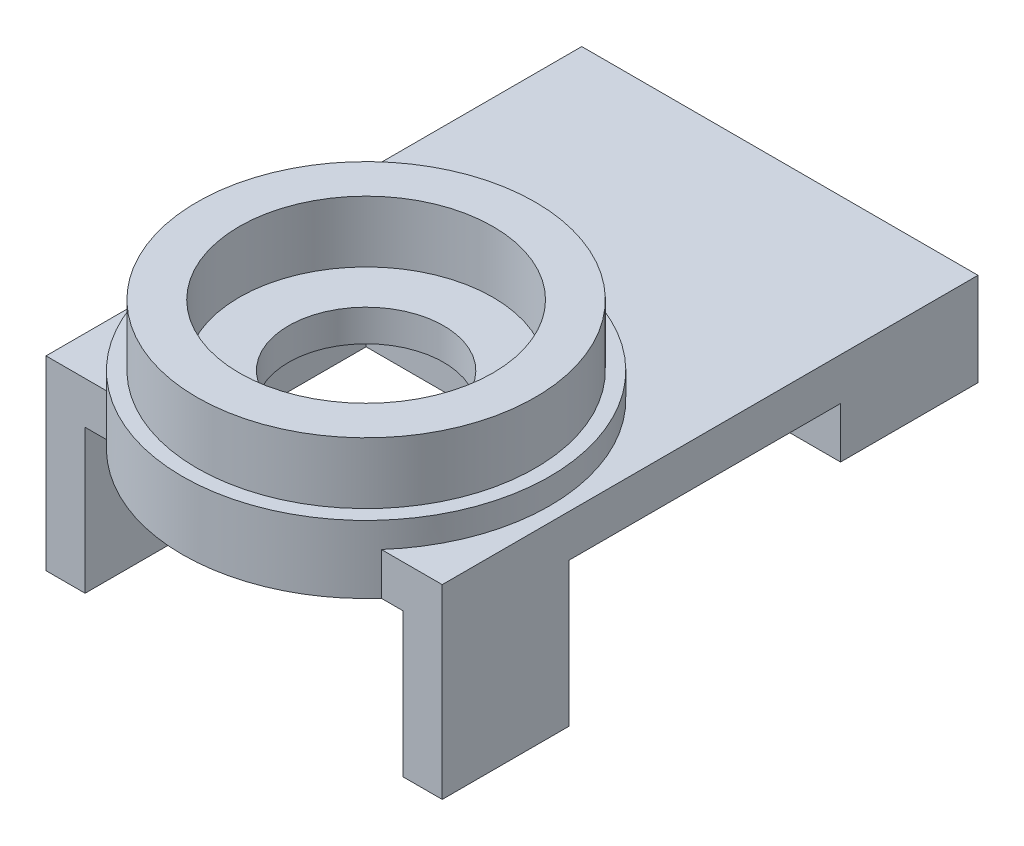
from build123d import *

# Parameters (mm, degrees)
SKETCH2_W           = 8.34
SKETCH2_H           = 8.34
BOSS_EXTRUDE2_DEPTH = 1.5
CUT_EXTRUDE1_DEPTH  = 1.5
BOSS_EXTRUDE4_DEPTH = 3.2
SKETCH6_R           = 8.685
SKETCH6_W           = 11.34
SKETCH6_H           = 11.34
BOSS_EXTRUDE5_DEPTH = 3.2
SKETCH8_R           = 8
SKETCH8_R_2         = 6
BOSS_EXTRUDE6_DEPTH = 2.9
BOSS_EXTRUDE7_START = -2
BOSS_EXTRUDE7_DEPTH = 2
SKETCH11_W          = 18.74
SKETCH11_H          = 6.5
BOSS_EXTRUDE8_DEPTH = 2.4
SKETCH12_W          = 1.85
SKETCH12_H          = 6
BOSS_EXTRUDE9_DEPTH = 6.8


with BuildPart() as part:
    # Sketch2 → Boss-Extrude2 (new body)
    with BuildSketch(Plane(origin=(0, 0, 0), x_dir=(1, 0, 0), z_dir=(0, 1, 0))):
        with Locations((2.034857004, -1.978756257)):
            Rectangle(SKETCH2_W, SKETCH2_H)
    extrude(amount=BOSS_EXTRUDE2_DEPTH)

    # Sketch3 → Cut-Extrude1 (cut)
    with BuildSketch(Plane(origin=(0, 1.5, 0), x_dir=(1, 0, 0), z_dir=(0, 1, 0))):
        with BuildLine():
            ThreePointArc((5.704857004, -1.978756257), (4.629938891, 0.61632563), (2.034857004, 1.691243743))
            Line((2.034857004, 1.691243743), (2.034857004, -5.648756257))
            ThreePointArc((2.034857004, -5.648756257), (4.629938891, -4.573838143), (5.704857004, -1.978756257))
        make_face()
        with BuildLine():
            Line((2.034857004, -5.648756257), (2.034857004, 1.691243743))
            ThreePointArc((2.034857004, 1.691243743), (-1.635142996, -1.978756257), (2.034857004, -5.648756257))
        make_face()
    extrude(amount=-CUT_EXTRUDE1_DEPTH, mode=Mode.SUBTRACT)

    # Sketch5 → Boss-Extrude4 (add)
    with BuildSketch(Plane(origin=(0, 1.5, 0), x_dir=(1, 0, 0), z_dir=(0, 1, 0))):
        Polygon((-2.135142996, -6.148756257), (-2.135142996, 2.191243743), (-3.635142996, 2.191243743), (-3.635142996, -7.648756257), (6.204857004, -7.648756257), (6.204857004, -6.148756257), align=None)
        Polygon((7.704857004, 3.691243743), (7.704857004, -7.648756257), (6.204857004, -7.648756257), (6.204857004, -6.148756257), (6.204857004, 2.191243743), (-2.135142996, 2.191243743), (-3.635142996, 2.191243743), (-3.635142996, 3.691243743), align=None)
    extrude(amount=-BOSS_EXTRUDE4_DEPTH)

    # Sketch6 → Boss-Extrude5 (add)
    with BuildSketch(Plane(origin=(0, 1.5, 0), x_dir=(1, 0, 0), z_dir=(0, 1, 0))):
        with Locations(Location((2.034857004, -1.978756257, 0), (0, 0, 270))):
            Circle(SKETCH6_R)
        with Locations((2.034857004, -1.978756257)):
            Rectangle(SKETCH6_W, SKETCH6_H, mode=Mode.SUBTRACT)
    extrude(amount=-BOSS_EXTRUDE5_DEPTH)

    # Sketch8 → Boss-Extrude6 (add)
    with BuildSketch(Plane(origin=(0, 1.5, 0), x_dir=(1, 0, 0), z_dir=(0, 1, 0))):
        with Locations(Location((2.034857004, -1.978756257, 0), (0, 0, 90))):
            Circle(SKETCH8_R)
        with Locations(Location((2.034857004, -1.978756257, 0), (0, 0, 270))):
            Circle(SKETCH8_R_2, mode=Mode.SUBTRACT)
    extrude(amount=BOSS_EXTRUDE6_DEPTH)

    # Sketch10 → Boss-Extrude7 (add)
    with BuildSketch(Plane.XZ.offset(1.7).offset(BOSS_EXTRUDE7_START)):
        with BuildLine():
            Line((6.204857004, -17.591243743), (6.204857004, -5.639663855))
            ThreePointArc((6.204857004, -5.639663855), (-4.10636539, -4.162466138), (-5.583563108, 6.148756257))
            Line((-5.583563108, 6.148756257), (-7.335142996, 6.148756257))
            Line((-7.335142996, 6.148756257), (-7.335142996, -17.591243743))
            Line((-7.335142996, -17.591243743), (6.204857004, -17.591243743))
        make_face()
        with BuildLine():
            Line((-7.335142996, 6.148756257), (-5.583563108, 6.148756257))
            ThreePointArc((-5.583563108, 6.148756257), (-5.065192067, 6.980608732), (-4.456392875, 7.748756257))
            Line((-4.456392875, 7.748756257), (-7.335142996, 7.748756257))
            Line((-7.335142996, 7.748756257), (-7.335142996, 6.148756257))
        make_face()
        with BuildLine():
            ThreePointArc((8.526106884, 7.748756257), (9.134906076, 6.980608732), (9.653277116, 6.148756257))
            Line((9.653277116, 6.148756257), (11.404857004, 6.148756257))
            Line((11.404857004, 6.148756257), (11.404857004, 7.748756257))
            Line((11.404857004, 7.748756257), (8.526106884, 7.748756257))
        make_face()
        with BuildLine():
            ThreePointArc((10.719857004, 1.978756257), (9.506325233, -2.449153804), (6.204857004, -5.639663855))
            Line((6.204857004, -5.639663855), (6.204857004, -17.591243743))
            Line((6.204857004, -17.591243743), (11.404857004, -17.591243743))
            Line((11.404857004, -17.591243743), (11.404857004, 6.148756257))
            Line((11.404857004, 6.148756257), (9.653277116, 6.148756257))
            ThreePointArc((9.653277116, 6.148756257), (10.448988084, 4.130876877), (10.719857004, 1.978756257))
        make_face()
    extrude(amount=BOSS_EXTRUDE7_DEPTH)

    # Sketch11 → Boss-Extrude8 (add)
    with BuildSketch(Plane.XZ.offset(1.7)):
        with Locations((2.034857004, -14.341243743)):
            Rectangle(SKETCH11_W, SKETCH11_H)
    extrude(amount=BOSS_EXTRUDE8_DEPTH)

    # Sketch12 → Boss-Extrude9 (add)
    with BuildSketch(Plane.XZ.offset(1.7)):
        with Locations((-6.410142996, 4.748756257)):
            Rectangle(SKETCH12_W, SKETCH12_H)
        with Locations((10.479857004, 4.748756257)):
            Rectangle(SKETCH12_W, SKETCH12_H)
    extrude(amount=BOSS_EXTRUDE9_DEPTH)


solid = part.part
